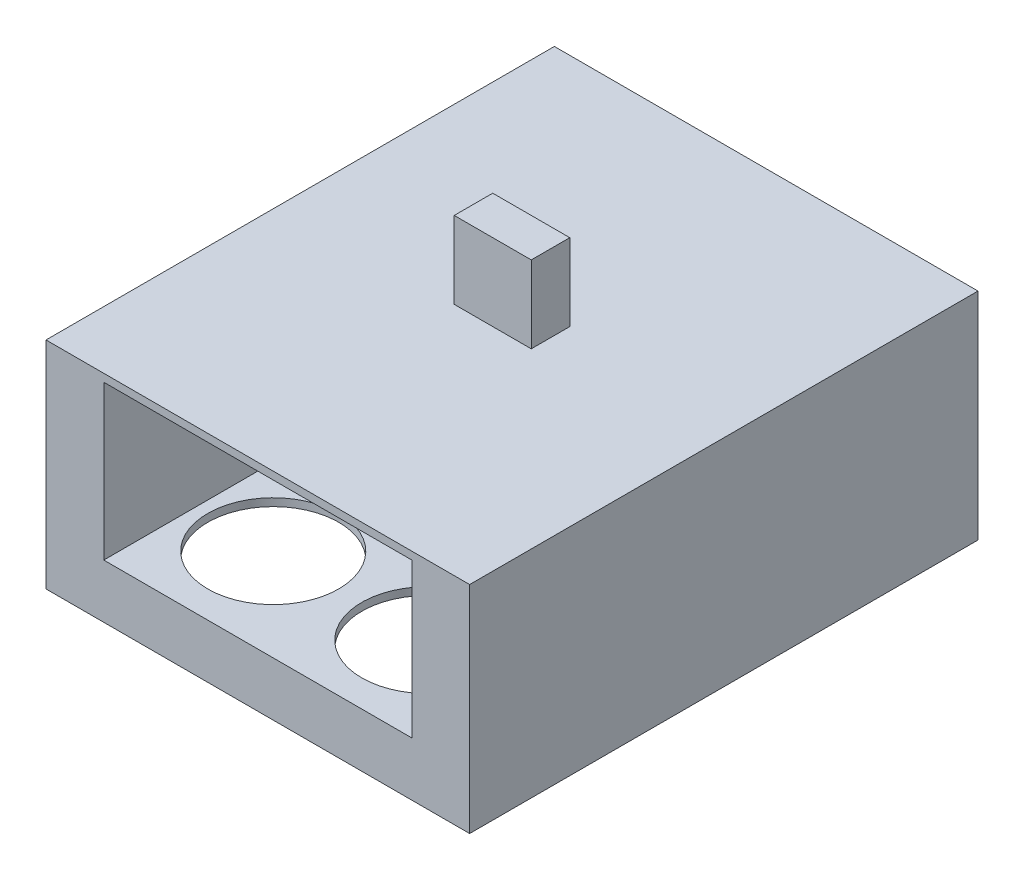
from build123d import *

# Parameters (mm, degrees)
SKETCH1_W           = 69.85
SKETCH1_H           = 6.35
BOSS_EXTRUDE1_DEPTH = 41.91
SHELL1_T            = -2.54
SKETCH2_W           = 69.85
SKETCH2_H           = 83.82
BOSS_EXTRUDE2_DEPTH = 25.4
SKETCH5_W           = 12.7
SKETCH5_H           = 12.7
BOSS_EXTRUDE5_DEPTH = 3.175
SKETCH6_W           = 50.8
SKETCH6_H           = 25.4
CUT_EXTRUDE1_DEPTH  = 30.48
CUT_EXTRUDE2_REACH  = 69.277
SKETCH7_R           = 10.795
SKETCH8_W           = 69.85
SKETCH8_H           = 83.82
SKETCH8_W_2         = 64.77
SKETCH8_H_2         = 78.74
BOSS_EXTRUDE6_DEPTH = 3.81


with BuildPart() as part:
    # Sketch1 → Boss-Extrude1 (new, symmetric)
    with BuildSketch(Plane.XY):
        with Locations((0, 3.175)):
            Rectangle(SKETCH1_W, SKETCH1_H)
    extrude(amount=BOSS_EXTRUDE1_DEPTH, both=True)

    # Shell1
    shell1_openings = [part.faces().sort_by_distance(p)[0] for p in [
        (0, 0, 0),
    ]]
    offset(amount=SHELL1_T, openings=shell1_openings, kind=Kind.INTERSECTION)

    # Sketch2 → Boss-Extrude2 (add)
    with BuildSketch(Plane(origin=(0, 6.35, 0), x_dir=(1, 0, 0), z_dir=(0, 1, 0))):
        Rectangle(SKETCH2_W, SKETCH2_H)
    extrude(amount=BOSS_EXTRUDE2_DEPTH)

    # Sketch5 → Boss-Extrude5 (add, symmetric)
    with BuildSketch(Plane.XY):
        with Locations((0, 38.1)):
            Rectangle(SKETCH5_W, SKETCH5_H)
    extrude(amount=BOSS_EXTRUDE5_DEPTH, both=True)

    # Sketch6 → Cut-Extrude1 (cut)
    with BuildSketch(Plane.XY.offset(41.91)):
        with Locations((0, 17.78)):
            Rectangle(SKETCH6_W, SKETCH6_H)
    extrude(amount=-CUT_EXTRUDE1_DEPTH, mode=Mode.SUBTRACT)

    # Sketch7 → Cut-Extrude2 (cut, up to next)
    with BuildSketch(Plane(origin=(0, 5.08, 0), x_dir=(1, 0, 0), z_dir=(0, 1, 0)), mode=Mode.PRIVATE) as cut_extrude2_sk1:
        with Locations(Location((-12.7, -26.67, 0), (0, 0, 270))):
            Circle(SKETCH7_R)
    cut_extrude2_tool1 = extrude(cut_extrude2_sk1.sketch, amount=-CUT_EXTRUDE2_REACH, mode=Mode.PRIVATE) & part.part
    # Sketch7 → Cut-Extrude2 (cut, up to next)
    with BuildSketch(Plane(origin=(0, 5.08, 0), x_dir=(1, 0, 0), z_dir=(0, 1, 0)), mode=Mode.PRIVATE) as cut_extrude2_sk2:
        with Locations(Location((12.7, -26.67, 0), (0, 0, 270))):
            Circle(SKETCH7_R)
    cut_extrude2_tool2 = extrude(cut_extrude2_sk2.sketch, amount=-CUT_EXTRUDE2_REACH, mode=Mode.PRIVATE) & part.part
    add(cut_extrude2_tool1.solids().sort_by_distance((-12.7, 5.08, 26.67))[0], mode=Mode.SUBTRACT)
    add(cut_extrude2_tool2.solids().sort_by_distance((12.7, 5.08, 26.67))[0], mode=Mode.SUBTRACT)

    # Sketch8 → Boss-Extrude6 (add)
    with BuildSketch(Plane.XZ):
        Rectangle(SKETCH8_W, SKETCH8_H)
        Rectangle(SKETCH8_W_2, SKETCH8_H_2, mode=Mode.SUBTRACT)
    extrude(amount=BOSS_EXTRUDE6_DEPTH)


solid = part.part
